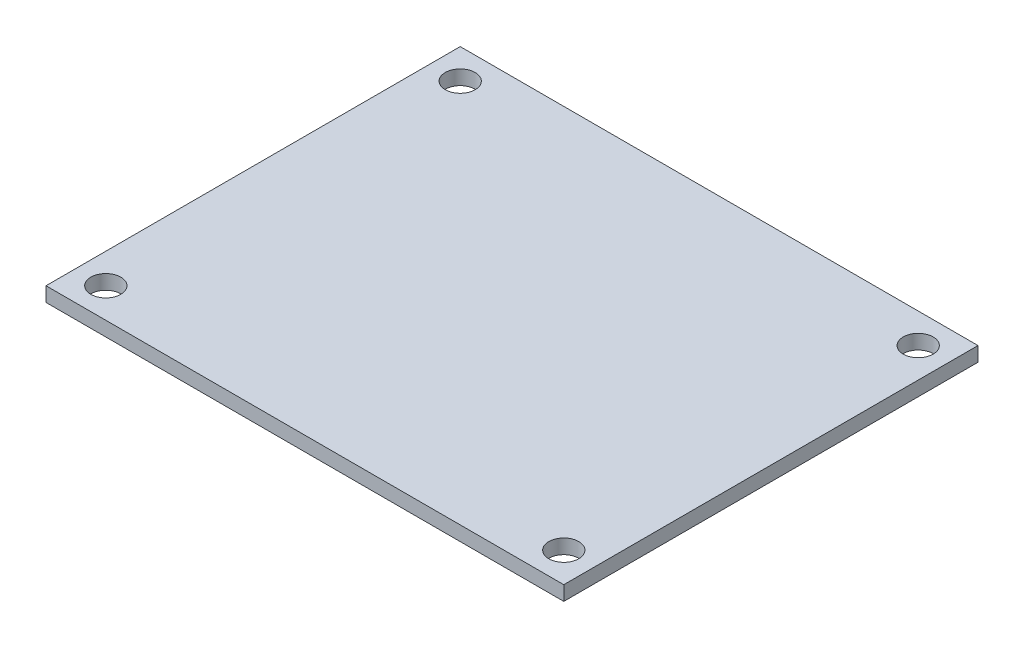
from build123d import *

# Parameters (mm, degrees)
SKETCH1_W               = 57.15
SKETCH1_H               = 45.72
BOSS_EXTRUDE1_DEPTH     = 1.600000102
SKETCH2_R               = 1.65
CUT_EXTRUDE1_DEPTH      = 63.907866186
MIRROR3_COPY_1_SKETCH_R = 1.65
MIRROR3_COPY_1_DEPTH    = 63.907866186


with BuildPart() as part:
    # Sketch1 → Boss-Extrude1 (new body)
    with BuildSketch(Plane(origin=(0, 0, 0), x_dir=(1, 0, 0), z_dir=(0, 1, 0))):
        with Locations((29.838090662, 0.437005539)):
            Rectangle(SKETCH1_W, SKETCH1_H)
    extrude(amount=BOSS_EXTRUDE1_DEPTH)

    # Sketch2 → Cut-Extrude1 (cut, through all)
    with BuildSketch(Plane(origin=(0, 1.600000102, 0), x_dir=(1, 0, 0), z_dir=(0, 1, 0))):
        with Locations(Location((4.563090662, 19.997005539, 0), (0, 0, 270))):
            Circle(SKETCH2_R)
    cut_extrude1 = extrude(amount=-CUT_EXTRUDE1_DEPTH, mode=Mode.SUBTRACT)

    # Mirror1: Cut-Extrude1 across plane
    add(cut_extrude1.mirror(Plane.XY.offset(-0.437005539)), mode=Mode.SUBTRACT)

    # Mirror3: Cut-Extrude1 across plane
    add(cut_extrude1.mirror(Plane.ZY.offset(-29.838090662)), mode=Mode.SUBTRACT)

    # Mirror3 copy 1 sketch → Mirror3 copy 1 (cut, through all)
    with BuildSketch(Plane(origin=(59.676181324, 1.600000102, -0.874011079), x_dir=(-1, 0, 0), z_dir=(0, 1, 0))):
        with Locations(Location((4.563090662, 19.997005539, 0), (0, 0, 270))):
            Circle(MIRROR3_COPY_1_SKETCH_R)
    extrude(amount=-MIRROR3_COPY_1_DEPTH, mode=Mode.SUBTRACT)


solid = part.part
